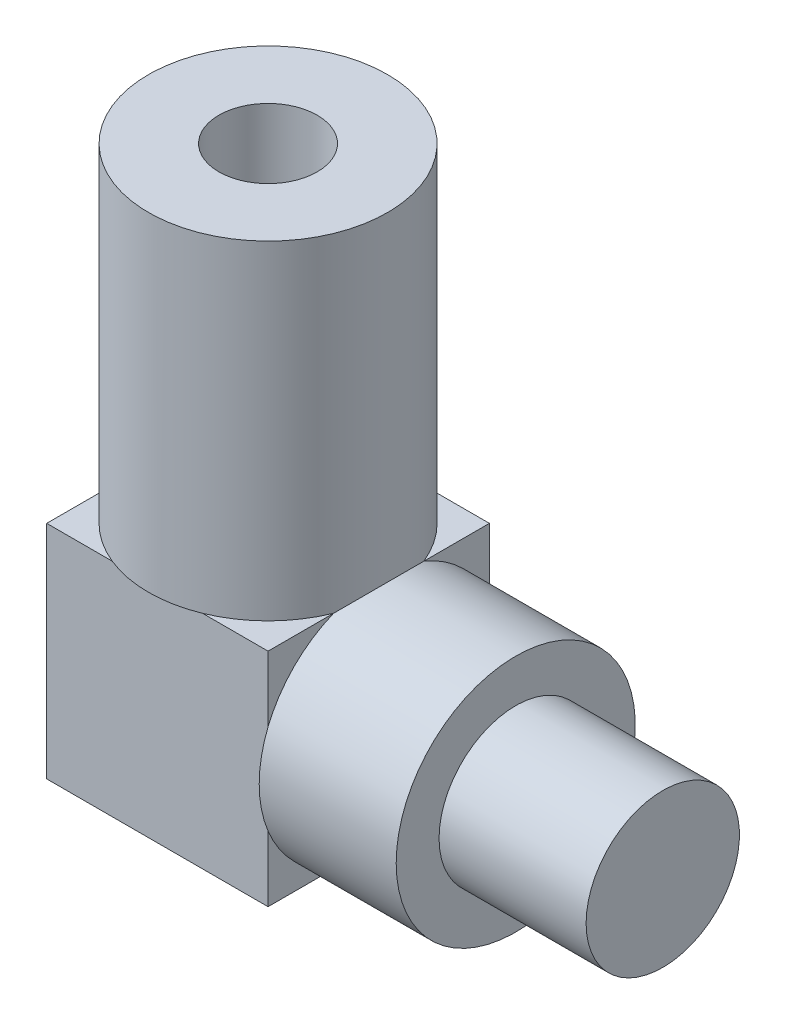
from build123d import *

# Parameters (mm, degrees)
BLOCK_SKETCH_W  = 14.3
BLOCK_SKETCH_H  = 14.3
BLOCK_DEPTH     = 7.15
ARM_SKETCH_W    = 7.722
ARM_SKETCH_H    = 21.25
SOCKET_SKETCH_W = 3.175
SOCKET_SKETCH_H = 16.2


with BuildPart() as part:
    # Block Sketch → Block (new, symmetric)
    with BuildSketch(Plane.XY):
        with Locations((-16, 0)):
            Rectangle(BLOCK_SKETCH_W, BLOCK_SKETCH_H)
    extrude(amount=BLOCK_DEPTH, both=True)

    # Neck and Stud Sketch → Neck and Stud (revolve)
    with BuildSketch(Plane.XY):
        Polygon((9.5, 0), (9.5, 4.953), (0, 4.953), (0, 7.722), (-8.85, 7.722), (-8.85, 0), align=None)
    revolve(axis=Axis((-1000, 0, 0), (1, 0, 0)))

    # Arm Sketch → Arm (revolve)
    with BuildSketch(Plane.XY):
        with Locations((-12.139, 17.775)):
            Rectangle(ARM_SKETCH_W, ARM_SKETCH_H)
    revolve(axis=Axis((-16, 0, 0), (0, 1, 0)))

    # Socket Sketch → Socket (revolve, cut)
    with BuildSketch(Plane.XY):
        with Locations((-14.4125, 21.3)):
            Rectangle(SOCKET_SKETCH_W, SOCKET_SKETCH_H)
    revolve(axis=Axis((-16, 0, 0), (0, 1, 0)), mode=Mode.SUBTRACT)


solid = part.part
